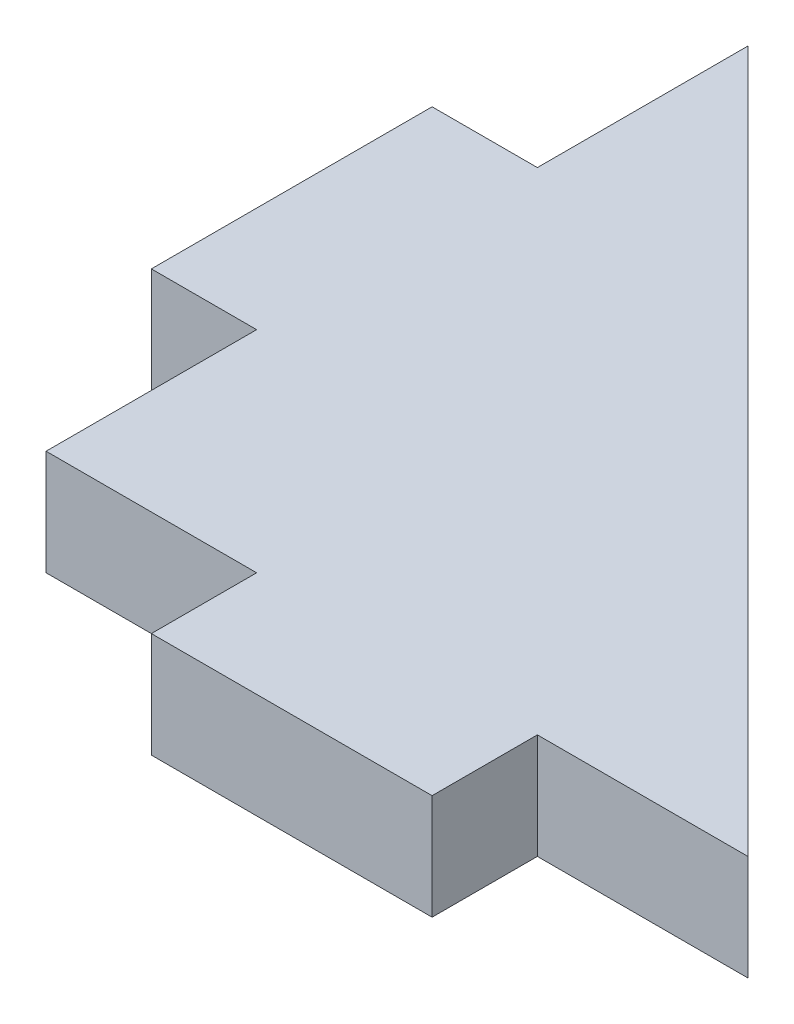
from build123d import *

# Parameters (mm, degrees)
SALIENTE_EXTRUIR1_DEPTH = 3


with BuildPart() as part:
    # Croquis1 → Saliente-Extruir1 (new body)
    with BuildSketch(Plane(origin=(0, 0, 0), x_dir=(1, 0, 0), z_dir=(0, 1, 0))):
        Polygon((0, 0), (6, 0), (6, -3), (10, -3), (14, -3), (14, 0), (20, 0), (0, 20), (0, 14), (-3, 14), (-3, 10), (-3, 6), (0, 6), align=None)
    extrude(amount=SALIENTE_EXTRUIR1_DEPTH)


solid = part.part
